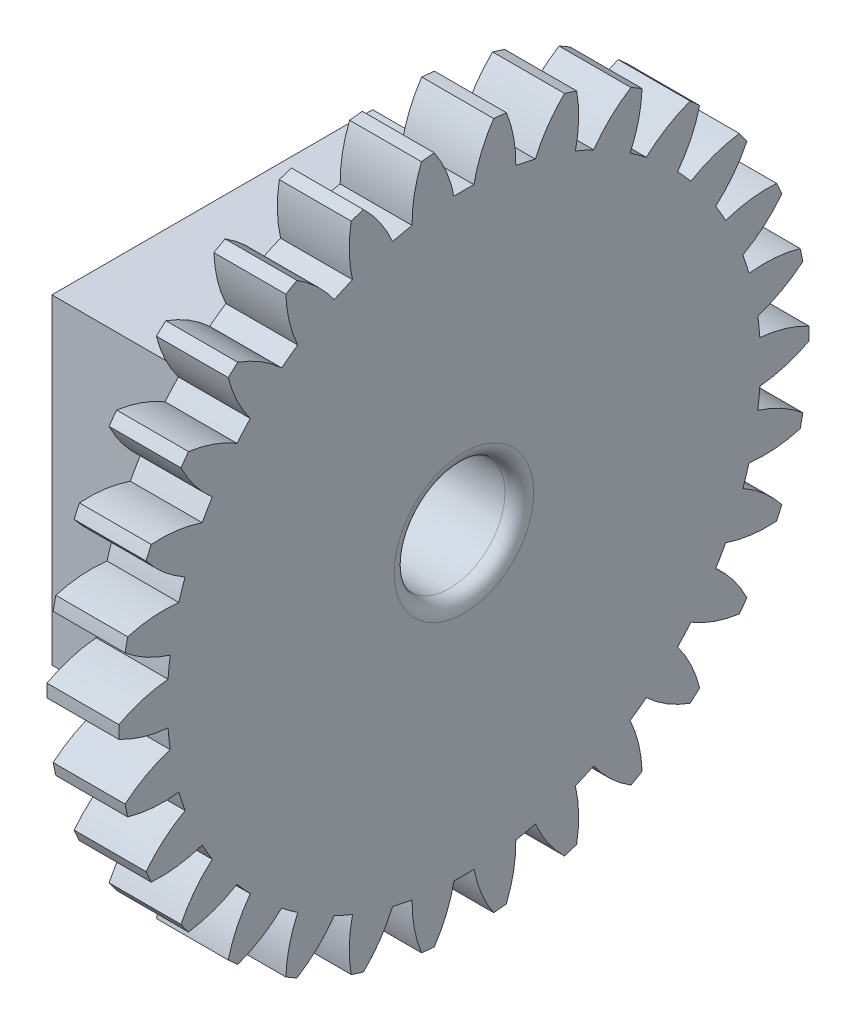
from build123d import *

# Parameters (mm, degrees)
BASPROSKE_W         = 10
BASPROSKE_H         = 48
TOOTHCUT_DEPTH      = 69.614867194
TEETHCUTS_COUNT     = 30
TEETHCUTS_ANGLE     = 348
BORSKE_R            = 5
BORE_DEPTH          = 50.0000508
SKETCH2_W           = 44.6
SKETCH2_H           = 44.6
BOSS_EXTRUDE1_DEPTH = 60
CUT_EXTRUDE1_REACH  = 99.421
SKETCH1_R           = 7.7
CUT_EXTRUDE2_REACH  = 106.024
SKETCH3_W           = 35
SKETCH3_H           = 44.6
FILLET1_R           = 2


with BuildPart() as part:
    # BasProSke → Base-Revolve (revolve)
    with BuildSketch(Plane(origin=(0, 0, 0), x_dir=(1, 0, 0), z_dir=(0, 1, 0)), mode=Mode.PRIVATE) as base_revolve_sk:
        with Locations((5, 24)):
            Rectangle(BASPROSKE_W, BASPROSKE_H)
    revolve(base_revolve_sk.sketch.rotate(Axis((-10, 0, 0), (1, 0, 0)), 180), axis=Axis((-10, 0, 0), (1, 0, 0)))

    # TooCutSke → ToothCut (cut, through all)
    with BuildSketch(Plane(origin=(0, 0, 0), x_dir=(0, 0, -1), z_dir=(1, 0, 0))):
        with BuildLine():
            ThreePointArc((1.388358102, 41.225628713), (0, 41.249), (-1.388358102, 41.225628713))
            ThreePointArc((-1.388358102, 41.225628713), (-2.434419088, 44.674608087), (-4.146627223, 47.846050285))
            ThreePointArc((-4.146627223, 47.846050285), (0, 48.0254), (4.146627223, 47.846050285))
            ThreePointArc((4.146627223, 47.846050285), (2.434419088, 44.674608087), (1.388358102, 41.225628713))
        make_face()
    toothcut = extrude(amount=TOOTHCUT_DEPTH, mode=Mode.SUBTRACT)

    # TeethCuts: ToothCut ×30 about axis
    teethcuts_axis = Axis((-10, 0, 0), (1, 0, 0))
    for i in range(1, TEETHCUTS_COUNT):
        add(toothcut.rotate(teethcuts_axis, i * TEETHCUTS_ANGLE / (TEETHCUTS_COUNT - 1)), mode=Mode.SUBTRACT)

    # BorSke → Bore (cut, symmetric)
    with BuildSketch(Plane(origin=(0, 0, 0), x_dir=(0, 0, -1), z_dir=(1, 0, 0))):
        with Locations(Location((0, 0, 0), (0, 0, 180))):
            Circle(BORSKE_R)
    extrude(amount=BORE_DEPTH, both=True, mode=Mode.SUBTRACT)

    # Sketch2 → Boss-Extrude1 (add)
    with BuildSketch(Plane.ZY):
        Rectangle(SKETCH2_W, SKETCH2_H)
    extrude(amount=BOSS_EXTRUDE1_DEPTH)

    # Sketch1 → Cut-Extrude1 (cut, up to next)
    with BuildSketch(Plane(origin=(10, 0, 0), x_dir=(0, 0, -1), z_dir=(1, 0, 0)), mode=Mode.PRIVATE) as cut_extrude1_sk1:
        Circle(SKETCH1_R)
    cut_extrude1_tool1 = extrude(cut_extrude1_sk1.sketch, amount=-CUT_EXTRUDE1_REACH, mode=Mode.PRIVATE) & part.part
    add(cut_extrude1_tool1.solids().sort_by_distance((10, 0, 0))[0], mode=Mode.SUBTRACT)

    # Sketch3 → Cut-Extrude2 (cut, up to next)
    with BuildSketch(Plane(origin=(0, 22.3, 0), x_dir=(1, 0, 0), z_dir=(0, 1, 0)), mode=Mode.PRIVATE) as cut_extrude2_sk1:
        with Locations((-42.5, 0)):
            Rectangle(SKETCH3_W, SKETCH3_H)
    cut_extrude2_tool1 = extrude(cut_extrude2_sk1.sketch, amount=-CUT_EXTRUDE2_REACH, mode=Mode.PRIVATE) & part.part
    add(cut_extrude2_tool1.solids().sort_by_distance((-42.5, 22.3, 0))[0], mode=Mode.SUBTRACT)

    # Fillet1
    fillet1_edges = [part.edges().sort_by_distance(p)[0] for p in [
        (10, 0, 7.7),
        (-25, 0, 7.7),
    ]]
    fillet(fillet1_edges, radius=FILLET1_R)


solid = part.part
